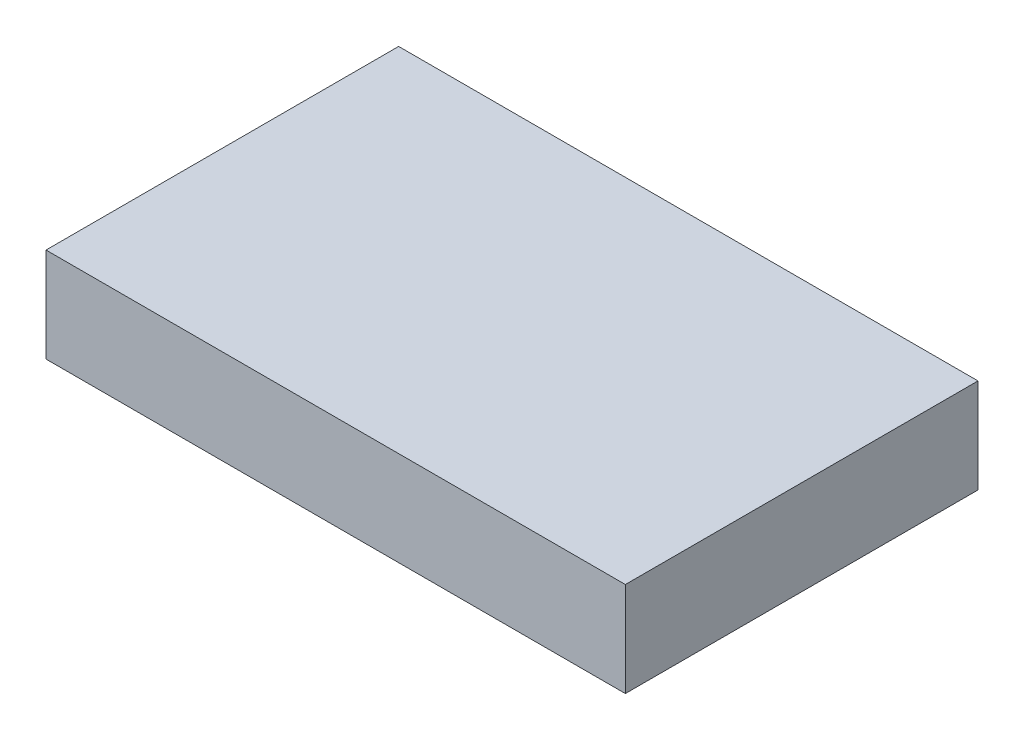
from build123d import *

# Parameters (mm, degrees)
SKETCH1_W           = 92
SKETCH1_H           = 56
BOSS_EXTRUDE1_DEPTH = 15


with BuildPart() as part:
    # Sketch1 → Boss-Extrude1 (new body)
    with BuildSketch(Plane(origin=(0, 0, 0), x_dir=(1, 0, 0), z_dir=(0, 1, 0))):
        with Locations((-220.142857143, 87.821428571)):
            Rectangle(SKETCH1_W, SKETCH1_H)
    extrude(amount=BOSS_EXTRUDE1_DEPTH)


solid = part.part
